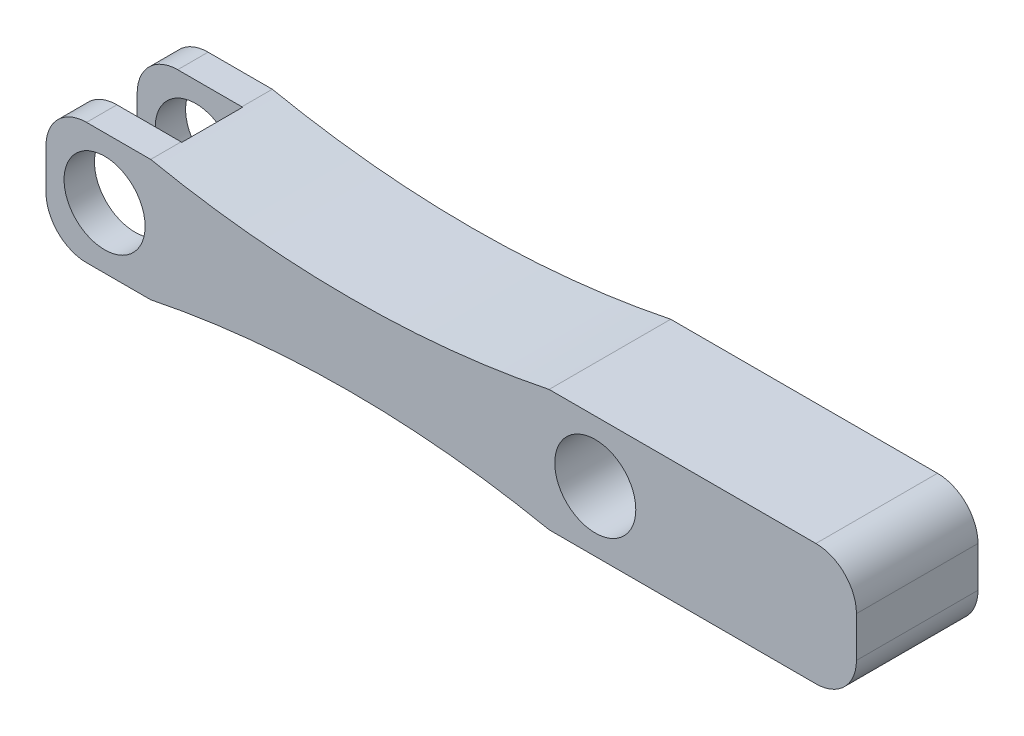
from build123d import *

# Parameters (mm, degrees)
SKETCH1_W           = 200
SKETCH1_H           = 30
BOSS_EXTRUDE1_DEPTH = 30
FILLET1_R           = 10
CUT_EXTRUDE1_DEPTH  = 30
SKETCH4_W           = 15
SKETCH4_H           = 30
CUT_EXTRUDE3_DEPTH  = 26
SKETCH5_R           = 10
CUT_EXTRUDE4_DEPTH  = 45
SCALE1_SCALE        = 4


with BuildPart() as part:
    # Sketch1 → Boss-Extrude1 (new body)
    with BuildSketch(Plane.XY):
        with Locations((46.259717806, -4.797058824)):
            Rectangle(SKETCH1_W, SKETCH1_H)
    extrude(amount=BOSS_EXTRUDE1_DEPTH)

    # Fillet1
    fillet1_edges = [part.edges().sort_by_distance(p)[0] for p in [
        (-53.740282194, 10.202941176, 15),
        (146.259717806, 10.202941176, 15),
        (146.259717806, -19.797058824, 15),
        (-53.740282194, -19.797058824, 15),
    ]]
    fillet(fillet1_edges, radius=FILLET1_R)

    # Sketch2 → Cut-Extrude1 (cut)
    with BuildSketch(Plane.XY.offset(30)):
        with BuildLine():
            Line((-27.901084514, 10.202941176), (70.420520136, 10.202941176))
            ThreePointArc((70.420520136, 10.202941176), (21.259717811, 5.202941178), (-27.901084514, 10.202941176))
        make_face()
        with BuildLine():
            Line((-27.901084524, -19.797058824), (70.420520136, -19.797058824))
            ThreePointArc((70.420520136, -19.797058824), (21.259717806, -14.798405243), (-27.901084524, -19.797058824))
        make_face()
    extrude(amount=-CUT_EXTRUDE1_DEPTH, mode=Mode.SUBTRACT)

    # Sketch4 → Cut-Extrude3 (cut)
    with BuildSketch(Plane.ZY.offset(53.740282194)):
        with Locations((15, -4.797058824)):
            Rectangle(SKETCH4_W, SKETCH4_H)
    extrude(amount=-CUT_EXTRUDE3_DEPTH, mode=Mode.SUBTRACT)

    # Sketch5 → Cut-Extrude4 (cut)
    with BuildSketch(Plane.XY.offset(30)):
        with Locations((-39.286224807, -4.797058824)):
            Circle(SKETCH5_R)
        with Locations((81.809717806, -4.797058824)):
            Circle(SKETCH5_R)
    extrude(amount=-CUT_EXTRUDE4_DEPTH, mode=Mode.SUBTRACT)


with BuildPart() as part_1:
    # Scale1: scaled about (57.695562261, -4.797279973, 15)
    add(part.part.scale(SCALE1_SCALE).moved(Location((-173.086686783, 14.391839919, -45))))


solid = part_1.part
